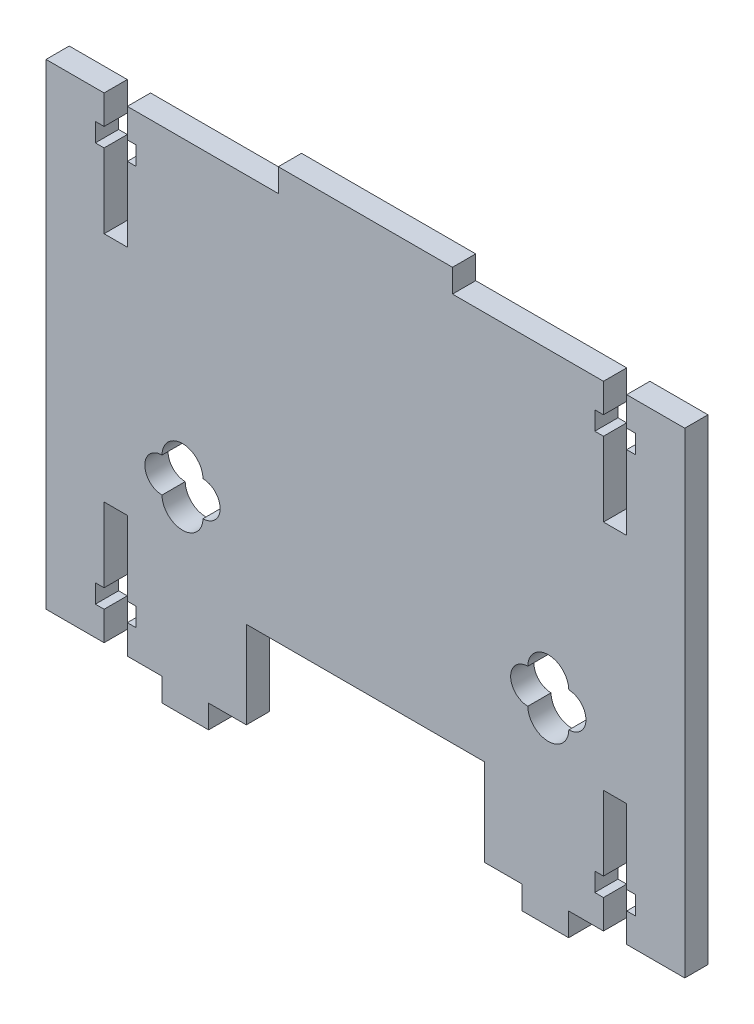
from build123d import *

# Parameters (mm, degrees)
BOSS_EXTRUDE1_DEPTH = 4
CUT_EXTRUDE1_DEPTH  = 5
CUT_EXTRUDE2_DEPTH  = 10
SKETCH4_W           = 8
SKETCH4_H           = 4
BOSS_EXTRUDE2_DEPTH = 4


with BuildPart() as part:
    # Sketch1 → Boss-Extrude1 (new body)
    with BuildSketch(Plane.XY):
        Polygon((20.5, -41), (20.5, -26), (-20.5, -26), (-20.5, -41), (-55, -41), (-55, 41), (-15, 41), (-15, 45), (15, 45), (15, 41), (55, 41), (55, -41), align=None)
    extrude(amount=BOSS_EXTRUDE1_DEPTH)

    # Sketch2 → Cut-Extrude1 (cut)
    with BuildSketch(Plane(origin=(0, 0, 0), x_dir=(-1, 0, 0), z_dir=(0, 0, -1))):
        Polygon((-41, -36), (-41, -41), (-45, -41), (-45, -36), (-46.5, -36), (-46.5, -32.8), (-45, -32.8), (-45, -20), (-41, -20), (-41, -32.8), (-39.5, -32.8), (-39.5, -36), align=None)
        Polygon((45, -41), (45, -36), (46.5, -36), (46.5, -32.8), (45, -32.8), (45, -20), (41, -20), (41, -32.8), (39.5, -32.8), (39.5, -36), (41, -36), (41, -41), align=None)
        Polygon((41, 36), (41, 41), (45, 41), (45, 36), (46.5, 36), (46.5, 32.8), (45, 32.8), (45, 20), (41, 20), (41, 32.8), (39.5, 32.8), (39.5, 36), align=None)
        Polygon((-45, 41), (-45, 36), (-46.5, 36), (-46.5, 32.8), (-45, 32.8), (-45, 20), (-41, 20), (-41, 32.8), (-39.5, 32.8), (-39.5, 36), (-41, 36), (-41, 41), align=None)
    extrude(amount=-CUT_EXTRUDE1_DEPTH, mode=Mode.SUBTRACT)

    # Sketch3 → Cut-Extrude2 (cut)
    with BuildSketch(Plane(origin=(0, 0, 0), x_dir=(-1, 0, 0), z_dir=(0, 0, -1))):
        with BuildLine():
            ThreePointArc((-27.96981837, -8.015850853), (-31.5, -4.536419435), (-35.03018163, -8.015850853))
            ThreePointArc((-35.03018163, -8.015850853), (-37.984301772, -11), (-35.03018163, -13.984149147))
            ThreePointArc((-35.03018163, -13.984149147), (-31.5, -17.463580565), (-27.96981837, -13.984149147))
            ThreePointArc((-27.96981837, -13.984149147), (-25.015698228, -11), (-27.96981837, -8.015850853))
        make_face()
        with BuildLine():
            ThreePointArc((35.03018163, -8.015850853), (37.984301772, -11), (35.03018163, -13.984149147))
            ThreePointArc((35.03018163, -13.984149147), (31.5, -17.463580565), (27.96981837, -13.984149147))
            ThreePointArc((27.96981837, -13.984149147), (25.015698228, -11), (27.96981837, -8.015850853))
            ThreePointArc((27.96981837, -8.015850853), (31.5, -4.536419435), (35.03018163, -8.015850853))
        make_face()
    extrude(amount=-CUT_EXTRUDE2_DEPTH, mode=Mode.SUBTRACT)

    # Sketch4 → Boss-Extrude2 (add)
    with BuildSketch(Plane(origin=(0, 0, 0), x_dir=(-1, 0, 0), z_dir=(0, 0, -1))):
        with Locations((-31, -43)):
            Rectangle(SKETCH4_W, SKETCH4_H)
        with Locations((31, -43)):
            Rectangle(SKETCH4_W, SKETCH4_H)
    extrude(amount=-BOSS_EXTRUDE2_DEPTH)


solid = part.part
